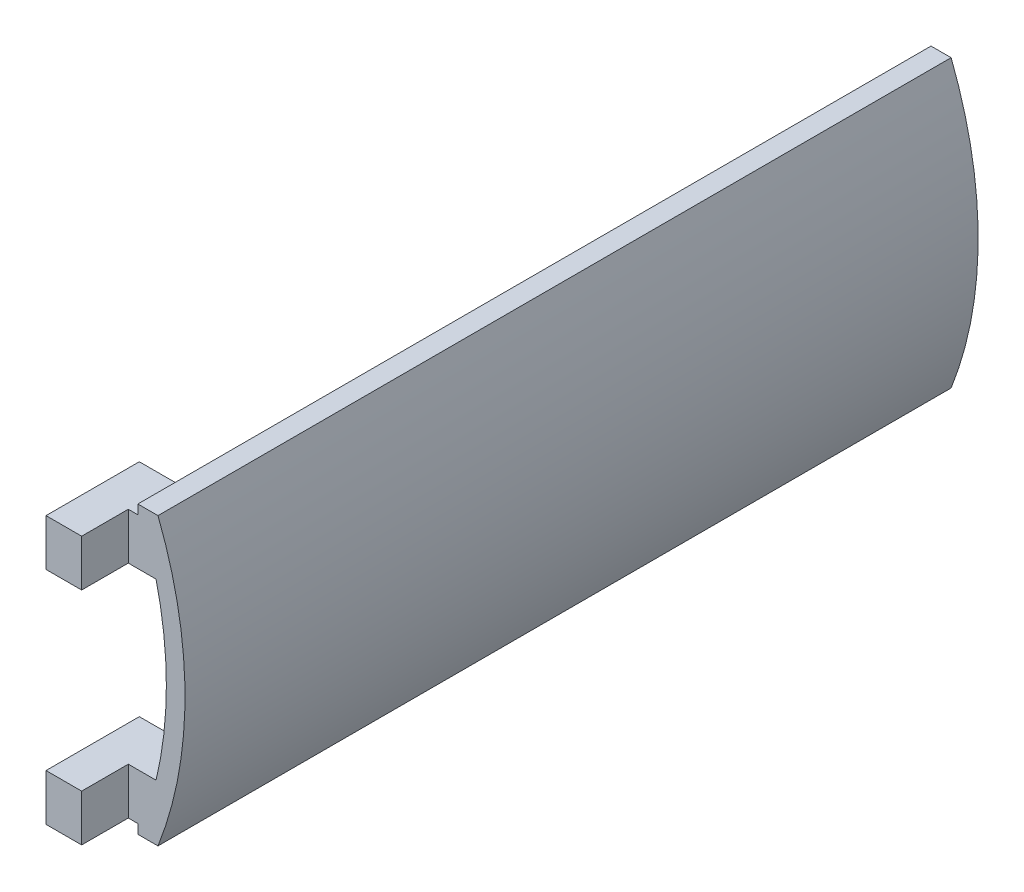
from build123d import *

# Parameters (mm, degrees)
EXTRUDE_1_DEPTH = 85
EXTRUDE_START   = -5
EXTRUDE_2_DEPTH = 5
SKETCH_3_W      = 3.820447187
SKETCH_3_H      = 5
EXTRUDE_3_DEPTH = 5
EXTRUDE_4_DEPTH = 5
SKETCH_5_W      = 3.820447187
SKETCH_5_H      = 5
EXTRUDE_5_DEPTH = 5


with BuildPart() as part:
    # Эскиз1 → Бобышка-Вытянуть1 (new body)
    with BuildSketch(Plane(origin=(0, 0, 0), x_dir=(-1, 0, 0), z_dir=(0, 0, -1))):
        with BuildLine():
            Line((-36.94590636, 15.329709821), (-39.102429551, 15.329709821))
            ThreePointArc((-39.102429551, 15.329709821), (-42, 0), (-39.102429551, -15.329709821))
            Line((-39.102429551, -15.329709821), (-36.94590636, -15.329709821))
            ThreePointArc((-36.94590636, -15.329709821), (-40, 0), (-36.94590636, 15.329709821))
        make_face()
    extrude(amount=-EXTRUDE_1_DEPTH)

    # Эскиз2 → Бобышка-Вытянуть2 (add)
    with BuildSketch(Plane.XY.offset(85).offset(EXTRUDE_START)):
        with BuildLine():
            Line((36.94590636, 15.329709821), (36.94590636, 14.329709821))
            Line((36.94590636, 14.329709821), (32.102429551, 14.329709821))
            Line((32.102429551, 14.329709821), (32.102429551, 9.329709821))
            Line((32.102429551, 9.329709821), (38.896741697, 9.329709821))
            ThreePointArc((38.896741697, 9.329709821), (38.039805679, 12.368232853), (36.94590636, 15.329709821))
        make_face()
    extrude(amount=EXTRUDE_2_DEPTH)

    # Эскиз3 → Бобышка-Вытянуть3 (add)
    with BuildSketch(Plane.XY.offset(85)):
        with Locations((34.012653144, 11.829709821)):
            Rectangle(SKETCH_3_W, SKETCH_3_H)
    extrude(amount=EXTRUDE_3_DEPTH)

    # Эскиз4 → Бобышка-Вытянуть4 (add)
    with BuildSketch(Plane.XY.offset(85).offset(EXTRUDE_START)):
        with BuildLine():
            Line((32.102429551, -14.329709821), (36.94590636, -14.329709821))
            Line((36.94590636, -14.329709821), (36.94590636, -15.329709821))
            ThreePointArc((36.94590636, -15.329709821), (38.039805679, -12.368232853), (38.896741697, -9.329709821))
            Line((38.896741697, -9.329709821), (32.102429551, -9.329709821))
            Line((32.102429551, -9.329709821), (32.102429551, -14.329709821))
        make_face()
    extrude(amount=EXTRUDE_4_DEPTH)

    # Эскиз5 → Бобышка-Вытянуть5 (add)
    with BuildSketch(Plane.XY.offset(85)):
        with Locations((34.012653144, -11.829709821)):
            Rectangle(SKETCH_5_W, SKETCH_5_H)
    extrude(amount=EXTRUDE_5_DEPTH)


solid = part.part
